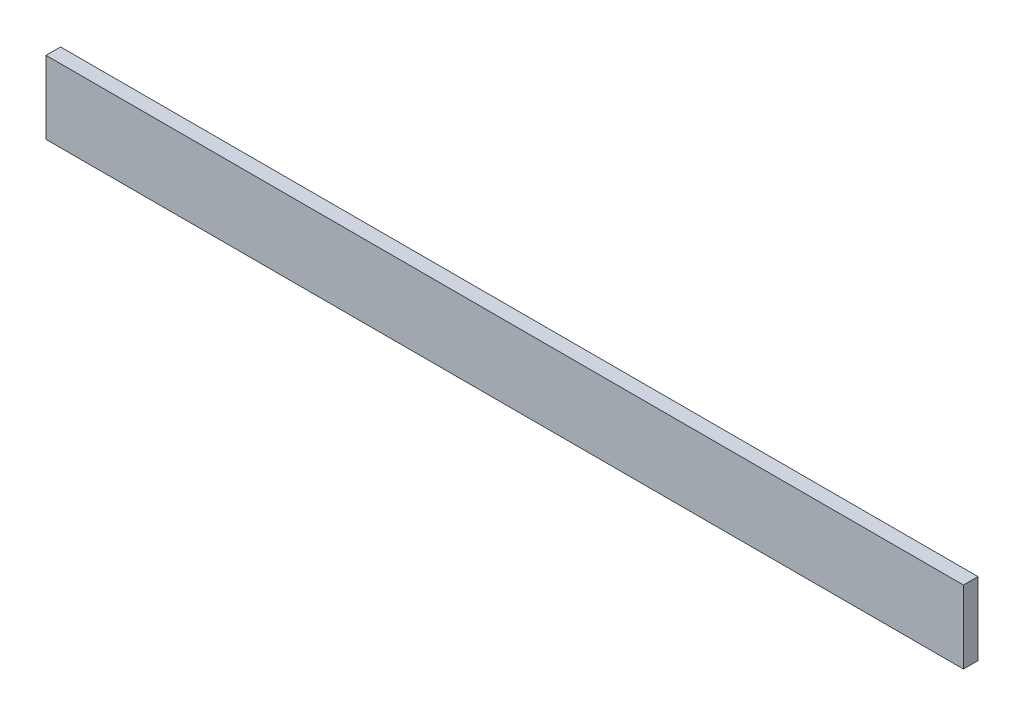
from build123d import *

# Parameters (mm, degrees)
IZIM1_W                     = 630
IZIM1_H                     = 50
Y_KSEKLIK_EKSTR_ZYON1_DEPTH = 10


with BuildPart() as part:
    # Çizim1 → Yükseklik-Ekstrüzyon1 (new body)
    with BuildSketch(Plane.XY):
        Rectangle(IZIM1_W, IZIM1_H)
    extrude(amount=Y_KSEKLIK_EKSTR_ZYON1_DEPTH)


solid = part.part
